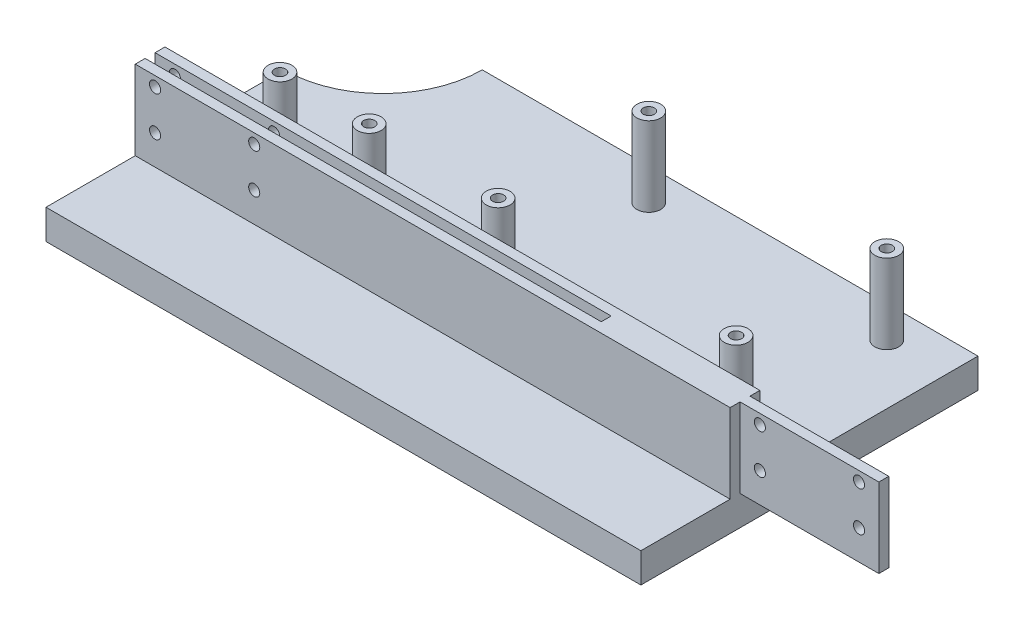
from build123d import *

# Parameters (mm, degrees)
BOSS_EXTRUDE1_DEPTH = 7.5
BOSS_EXTRUDE2_DEPTH = 20
SKETCH3_R           = 1.4
CUT_EXTRUDE1_DEPTH  = 10
SKETCH4_R           = 1.4
CUT_EXTRUDE2_DEPTH  = 10
SKETCH5_R           = 3
BOSS_EXTRUDE3_DEPTH = 20
SKETCH6_R           = 1.4
CUT_EXTRUDE3_DEPTH  = 8


with BuildPart() as part:
    # Sketch1 → Boss-Extrude1 (new body)
    with BuildSketch(Plane(origin=(0, 0, 0), x_dir=(1, 0, 0), z_dir=(0, 1, 0))):
        with BuildLine():
            Line((25, 85), (150, 85))
            Line((150, 85), (150, 0))
            Line((150, 0), (0, 0))
            Line((0, 0), (0, 60))
            ThreePointArc((0, 60), (17.67766953, 67.32233047), (25, 85))
        make_face()
    extrude(amount=BOSS_EXTRUDE1_DEPTH)

    # Sketch2 → Boss-Extrude2 (add)
    with BuildSketch(Plane(origin=(0, 7.5, 0), x_dir=(1, 0, 0), z_dir=(0, 1, 0))):
        Polygon((150, 30), (0, 30), (0, 27.5), (115, 27.5), (115, 25), (0, 25), (0, 22.5), (150, 22.5), (150, 25), (185, 25), (185, 27.5), (150, 27.5), align=None)
    extrude(amount=BOSS_EXTRUDE2_DEPTH)

    # Sketch3 → Cut-Extrude1 (cut)
    with BuildSketch(Plane.XY.offset(-22.5)):
        with Locations(Location((5, 25, 0), (0, 0, 180))):
            Circle(SKETCH3_R)
        with Locations(Location((5, 15, 0), (0, 0, 180))):
            Circle(SKETCH3_R)
        with Locations(Location((30, 25, 0), (0, 0, 180))):
            Circle(SKETCH3_R)
        with Locations(Location((30, 15, 0), (0, 0, 180))):
            Circle(SKETCH3_R)
    extrude(amount=-CUT_EXTRUDE1_DEPTH, mode=Mode.SUBTRACT)

    # Sketch4 → Cut-Extrude2 (cut)
    with BuildSketch(Plane.XY.offset(-25)):
        with Locations((155, 25)):
            Circle(SKETCH4_R)
        with Locations((180, 25)):
            Circle(SKETCH4_R)
        with Locations((180, 15)):
            Circle(SKETCH4_R)
        with Locations((155, 15)):
            Circle(SKETCH4_R)
    extrude(amount=-CUT_EXTRUDE2_DEPTH, mode=Mode.SUBTRACT)

    # Sketch5 → Boss-Extrude3 (add)
    with BuildSketch(Plane(origin=(0, 7.5, 0), x_dir=(1, 0, 0), z_dir=(0, 1, 0))):
        with Locations(Location((20, 39, 0), (0, 0, 270))):
            Circle(SKETCH5_R)
        with Locations(Location((42.5, 39, 0), (0, 0, 270))):
            Circle(SKETCH5_R)
        with Locations(Location((75, 77, 0), (0, 0, 270))):
            Circle(SKETCH5_R)
        with Locations(Location((135, 77, 0), (0, 0, 270))):
            Circle(SKETCH5_R)
        with Locations(Location((135, 39, 0), (0, 0, 270))):
            Circle(SKETCH5_R)
        with Locations(Location((75, 39, 0), (0, 0, 270))):
            Circle(SKETCH5_R)
    extrude(amount=BOSS_EXTRUDE3_DEPTH)

    # Sketch6 → Cut-Extrude3 (cut)
    with BuildSketch(Plane(origin=(0, 27.5, 0), x_dir=(1, 0, 0), z_dir=(0, 1, 0))):
        with Locations(Location((20, 39, 0), (0, 0, 270))):
            Circle(SKETCH6_R)
        with Locations(Location((42.5, 39, 0), (0, 0, 270))):
            Circle(SKETCH6_R)
        with Locations(Location((75, 77, 0), (0, 0, 270))):
            Circle(SKETCH6_R)
        with Locations(Location((75, 39, 0), (0, 0, 270))):
            Circle(SKETCH6_R)
        with Locations(Location((135, 39, 0), (0, 0, 270))):
            Circle(SKETCH6_R)
        with Locations(Location((135, 77, 0), (0, 0, 270))):
            Circle(SKETCH6_R)
    extrude(amount=-CUT_EXTRUDE3_DEPTH, mode=Mode.SUBTRACT)


solid = part.part
